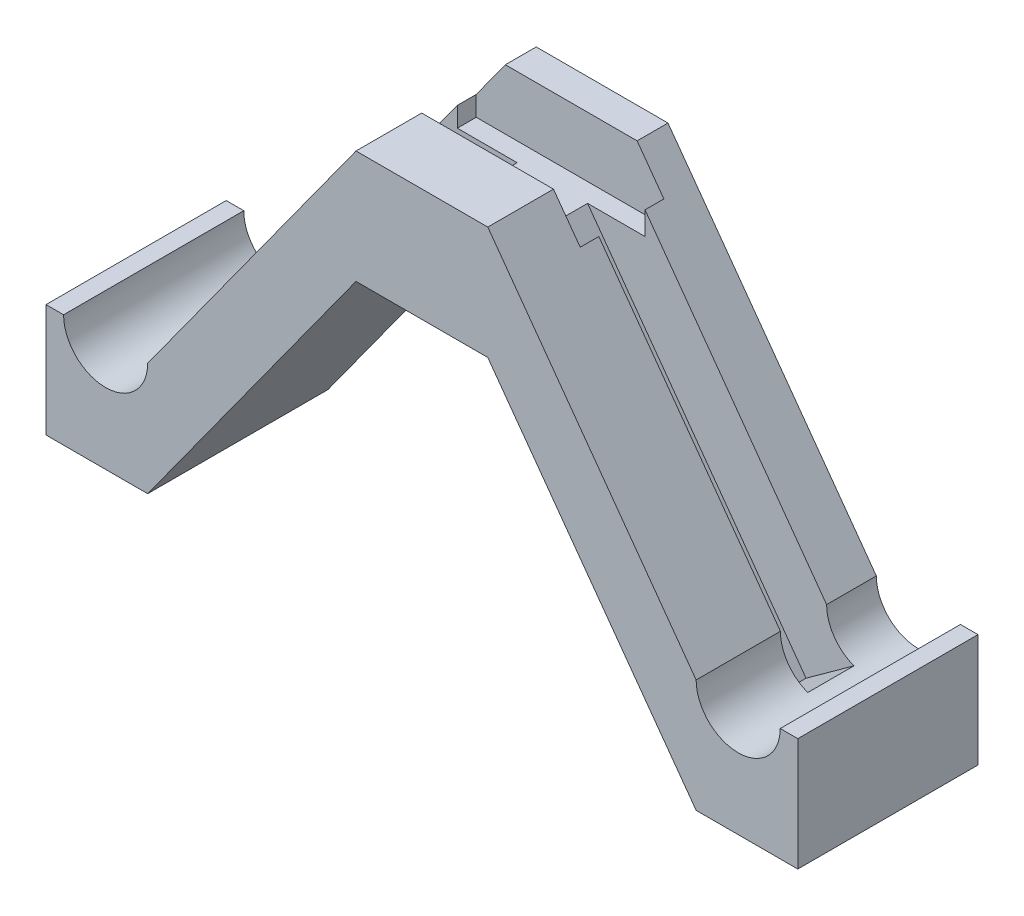
from build123d import *

# Parameters (mm, degrees)
BOSS_EXTRUDE1_DEPTH = 30
SKETCH3_W           = 31.24049206
SKETCH3_H           = 13.927985749
CUT_EXTRUDE1_DEPTH  = 10
SKETCH4_W           = 7.689934576
SKETCH4_H           = 62.184409798
CUT_EXTRUDE2_DEPTH  = 10


with BuildPart() as part:
    # Sketch2 → Boss-Extrude1 (new body)
    with BuildSketch(Plane.XY):
        with BuildLine():
            Line((-10.970149254, 0), (0, 0))
            Line((0, 0), (0, 18.805970149))
            Line((0, 18.805970149), (-10.970149254, 18.805970149))
            Line((-10.970149254, 18.805970149), (-45.656716418, -29.149253731))
            ThreePointArc((-45.656716418, -29.149253731), (-52.656716418, -36.149253731), (-59.656716418, -29.149253731))
            Line((-59.656716418, -29.149253731), (-62.582089552, -29.149253731))
            Line((-62.582089552, -29.149253731), (-62.582089552, -47.955223881))
            Line((-62.582089552, -47.955223881), (-45.656716418, -47.955223881))
            Line((-45.656716418, -47.955223881), (-10.970149254, 0))
        make_face()
        with BuildLine():
            Line((0, 0), (10.970149254, 0))
            Line((10.970149254, 0), (45.656716418, -47.955223881))
            Line((45.656716418, -47.955223881), (62.582089552, -47.955223881))
            Line((62.582089552, -47.955223881), (62.582089552, -29.149253731))
            Line((62.582089552, -29.149253731), (59.656716418, -29.149253731))
            ThreePointArc((59.656716418, -29.149253731), (52.656716418, -36.149253731), (45.656716418, -29.149253731))
            Line((45.656716418, -29.149253731), (10.970149254, 18.805970149))
            Line((10.970149254, 18.805970149), (0, 18.805970149))
            Line((0, 18.805970149), (0, 0))
        make_face()
    extrude(amount=BOSS_EXTRUDE1_DEPTH)

    # Sketch3 → Cut-Extrude1 (cut)
    with BuildSketch(Plane(origin=(0, 18.805970149, 0), x_dir=(1, 0, 0), z_dir=(0, 1, 0))):
        with Locations((-0.199336915, -12.101360071)):
            Rectangle(SKETCH3_W, SKETCH3_H)
    extrude(amount=-CUT_EXTRUDE1_DEPTH, mode=Mode.SUBTRACT)

    # Sketch4 → Cut-Extrude2 (cut)
    with BuildSketch(Plane(origin=(-16.132519574, 11.668837688, 0), x_dir=(0, 0, 1), z_dir=(-0.8102600819579188, 0.5860704732244638, 0))):
        with Locations((12.122562235, -27.26241609)):
            Rectangle(SKETCH4_W, SKETCH4_H)
    cut_extrude2 = extrude(amount=-CUT_EXTRUDE2_DEPTH, mode=Mode.SUBTRACT)

    # Mirror1: Cut-Extrude2 across plane
    add(cut_extrude2.mirror(Plane(origin=(0, 0, 0), x_dir=(0, 0, 1), z_dir=(1, 0, 0))), mode=Mode.SUBTRACT)


solid = part.part
